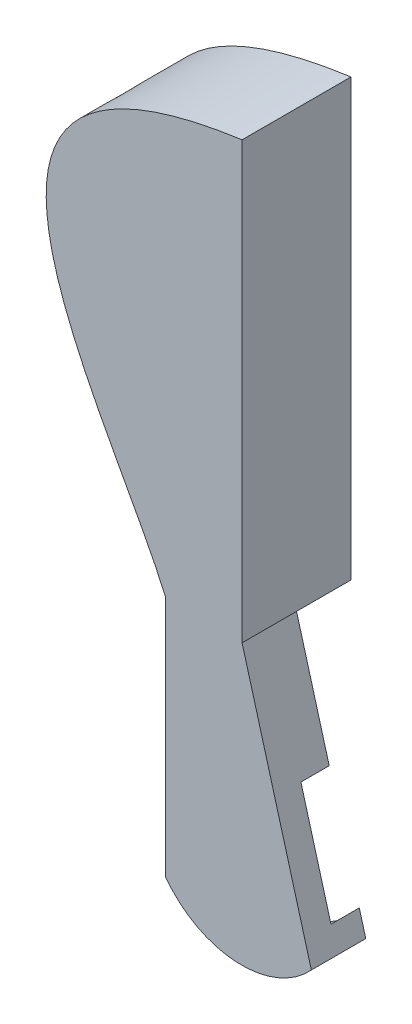
from build123d import *

# Parameters (mm, degrees)
BOSS_EXTRUDE1_DEPTH = 50
SKETCH3_W           = 66.376369139
SKETCH3_H           = 188.96079622
CUT_EXTRUDE1_DEPTH  = 305.408240944
SKETCH4_R           = 34.5
CUT_EXTRUDE2_DEPTH  = 13
CUT_EXTRUDE3_DEPTH  = 300.667940806


with BuildPart() as part:
    # Sketch1 → Boss-Extrude1 (new body)
    with BuildSketch(Plane.XY):
        with BuildLine():
            Line((0.221790001, 84.828286355), (0.2207262, 284.828286352))
            add(Edge.make_bspline(
                [(0.2207262, 284.828286352), (-159.978737061, 262.606607754), (-63.000724603, 150.139017081), (-35, 85.625)],
                knots=[0, 0, 0, 0, 1, 1, 1, 1], degree=3))
            Line((-35, 85.625), (-35, -85.625))
            Line((-35, -85.625), (35, -85.625))
            Line((35, -85.625), (35, -40.1019375))
            Line((35, -40.1019375), (0.221790001, 84.828286355))
        make_face()
    extrude(amount=BOSS_EXTRUDE1_DEPTH)

    # Sketch3 → Cut-Extrude1 (cut, through all)
    with BuildSketch(Plane(origin=(22.122011617, 6.158349372, 0), x_dir=(0, 0, -1), z_dir=(0.9633678796634119, 0.2681833858254875, 0))):
        with Locations((8.18818457, -12.819032142)):
            Rectangle(SKETCH3_W, SKETCH3_H)
    extrude(amount=-CUT_EXTRUDE1_DEPTH, mode=Mode.SUBTRACT)

    # Sketch4 → Cut-Extrude2 (cut)
    with BuildSketch(Plane(origin=(0, 0, 25), x_dir=(-1, 0, 0), z_dir=(0, 0, -1))):
        Circle(SKETCH4_R)
    extrude(amount=-CUT_EXTRUDE2_DEPTH, mode=Mode.SUBTRACT)

    # Sketch5 → Cut-Extrude3 (cut, through all)
    with BuildSketch(Plane(origin=(0, 0, 25), x_dir=(-1, 0, 0), z_dir=(0, 0, -1))):
        with BuildLine():
            Line((35, -40.1019375), (35, -85.625))
            Line((35, -85.625), (-35, -85.625))
            Line((-35, -85.625), (-35, -40.1019375))
            Line((-35, -40.1019375), (-32.013551407, -29.374022196))
            ThreePointArc((-32.013551407, -29.374022196), (2.35071235, -43.384038598), (35, -25.742972899))
            Line((35, -25.742972899), (35, -40.1019375))
        make_face()
    extrude(amount=-CUT_EXTRUDE3_DEPTH, mode=Mode.SUBTRACT)


solid = part.part
